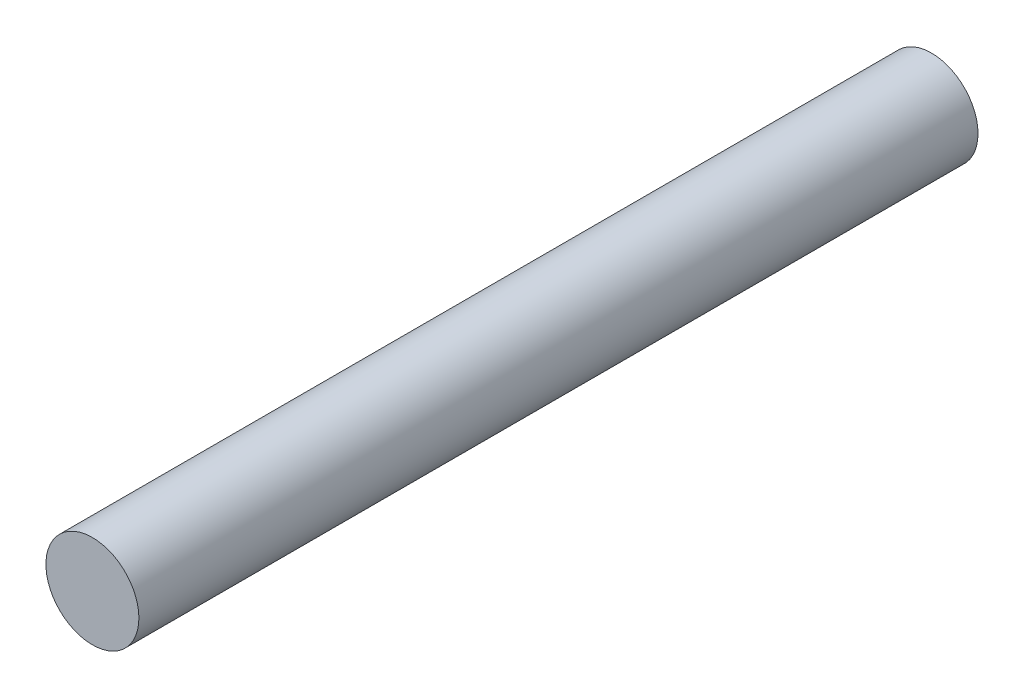
from build123d import *

# Parameters (mm, degrees)
SKETCH1_R           = 2.05
BOSS_EXTRUDE1_DEPTH = 37


with BuildPart() as part:
    # Sketch1 → Boss-Extrude1 (new body)
    with BuildSketch(Plane.XY):
        Circle(SKETCH1_R)
    extrude(amount=BOSS_EXTRUDE1_DEPTH)


solid = part.part
